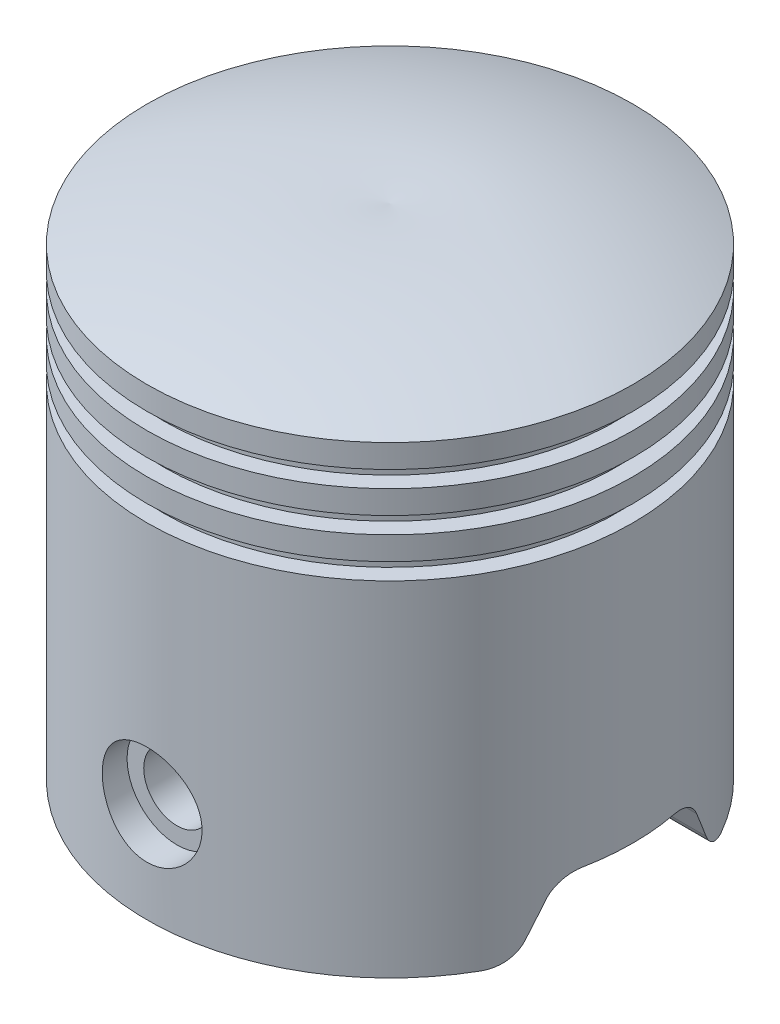
from build123d import *

# Parameters (mm, degrees)
CUT_EXTRUDE1_REACH                   = 93.307
CUT_EXTRUDE1_DIRECTION_2_REACH       = 93.307
FILLET1_R                            = 5
BOSS_EXTRUDE1_REACH                  = 93.307
BOSS_EXTRUDE1_END_RADIUS             = 30.50852022
SKETCH3_R                            = 9
BOSS_EXTRUDE1_DIRECTION_2_REACH      = 93.307
BOSS_EXTRUDE1_DIRECTION_2_END_RADIUS = 30.50852022
CUT_EXTRUDE2_REACH                   = 93.307
CUT_EXTRUDE2_END_RADIUS              = 36.50852022
SKETCH4_R                            = 5
CUT_EXTRUDE2_DIRECTION_2_REACH       = 93.307
CUT_EXTRUDE2_DIRECTION_2_END_RADIUS  = 36.50852022
SKETCH5_R                            = 7.5
CUT_EXTRUDE3_DEPTH                   = 10


with BuildPart() as part:
    # Sketch1 → Revolve1 (revolve)
    with BuildSketch(Plane.XY, mode=Mode.PRIVATE) as revolve1_sk:
        with BuildLine():
            Line((0, 65.6), (0, 70))
            Line((0, 70), (0, 75))
            ThreePointArc((0, 75), (-18.565651024, 74.469071932), (-36.50852022, 69.671288317))
            Line((-36.50852022, 69.671288317), (-36.50852022, 66.171288317))
            Line((-36.50852022, 66.171288317), (-34.00852022, 66.171288317))
            Line((-34.00852022, 66.171288317), (-34.00852022, 63.671288317))
            Line((-34.00852022, 63.671288317), (-36.50852022, 63.671288317))
            Line((-36.50852022, 63.671288317), (-36.50852022, 60.171288317))
            Line((-36.50852022, 60.171288317), (-34.00852022, 60.171288317))
            Line((-34.00852022, 60.171288317), (-34.00852022, 57.671288317))
            Line((-34.00852022, 57.671288317), (-36.50852022, 57.671288317))
            Line((-36.50852022, 57.671288317), (-36.50852022, 54.171288317))
            Line((-36.50852022, 54.171288317), (-34.00852022, 54.171288317))
            Line((-34.00852022, 54.171288317), (-34.00852022, 51.671288317))
            Line((-34.00852022, 51.671288317), (-36.50852022, 51.671288317))
            Line((-36.50852022, 51.671288317), (-36.50852022, 0))
            Line((-36.50852022, 0), (-30.50852022, 0))
            Line((-30.50852022, 0), (-30.50852022, 65.6))
            Line((-30.50852022, 65.6), (0, 65.6))
        make_face()
    revolve(revolve1_sk.sketch.rotate(Axis((0, 70, 0), (0, 1, 0)), 270), axis=Axis((0, 70, 0), (0, 1, 0)))

    # Sketch2 → Cut-Extrude1 (cut, up to next)
    with BuildSketch(Plane(origin=(0, 0, 0), x_dir=(0, 0, -1), z_dir=(1, 0, 0)), mode=Mode.PRIVATE) as cut_extrude1_sk1:
        Polygon((-15, 0), (-10, 10), (10, 10), (15, 0), align=None)
    cut_extrude1_tool1 = extrude(cut_extrude1_sk1.sketch, amount=-CUT_EXTRUDE1_REACH, mode=Mode.PRIVATE) & part.part
    add(cut_extrude1_tool1.solids().sort_by_distance((0, 4.666667, 0))[0], mode=Mode.SUBTRACT)

    # Sketch2 → Cut-Extrude1 direction 2 (cut, up to next)
    with BuildSketch(Plane(origin=(0, 0, 0), x_dir=(0, 0, -1), z_dir=(1, 0, 0)), mode=Mode.PRIVATE) as cut_extrude1_direction_2_sk1:
        Polygon((-15, 0), (-10, 10), (10, 10), (15, 0), align=None)
    cut_extrude1_direction_2_tool1 = extrude(cut_extrude1_direction_2_sk1.sketch, amount=CUT_EXTRUDE1_DIRECTION_2_REACH, mode=Mode.PRIVATE) & part.part
    add(cut_extrude1_direction_2_tool1.solids().sort_by_distance((0, 4.666667, 0))[0], mode=Mode.SUBTRACT)

    # Fillet1
    fillet1_edges = [part.edges().sort_by_distance(p)[0] for p in [
        (31.967677706, 10, -10),
        (-31.967677706, 10, -10),
        (29.92552018, 0, -15),
        (-29.92552018, 0, -15),
        (31.967677706, 10, 10),
        (-31.967677706, 10, 10),
        (-29.92552018, 0, 15),
        (29.92552018, 0, 15),
    ]]
    fillet(fillet1_edges, radius=FILLET1_R)

    # Boss-Extrude1: up to this cylinder (the profile starts inside it)
    boss_extrude1_end = Plane(origin=(0, 15, 0), z_dir=(0, -1, 0)) * Cylinder(BOSS_EXTRUDE1_END_RADIUS, 248.631040439, mode=Mode.PRIVATE)
    # Sketch3 → Boss-Extrude1 (add, up to the surface)
    with BuildSketch(Plane.XY, mode=Mode.PRIVATE) as boss_extrude1_sk1:
        with Locations((0, 15)):
            Circle(SKETCH3_R)
    boss_extrude1_tool1 = extrude(boss_extrude1_sk1.sketch, amount=BOSS_EXTRUDE1_REACH, mode=Mode.PRIVATE) & boss_extrude1_end
    add(boss_extrude1_tool1.solids().sort_by_distance((0, 15, 0))[0])

    # Boss-Extrude1 direction 2: up to this cylinder (the profile starts inside it)
    boss_extrude1_direction_2_end = Plane(origin=(0, 15, 0), z_dir=(0, -1, 0)) * Cylinder(BOSS_EXTRUDE1_DIRECTION_2_END_RADIUS, 248.631040439, mode=Mode.PRIVATE)
    # Sketch3 → Boss-Extrude1 direction 2 (add, up to the surface)
    with BuildSketch(Plane.XY, mode=Mode.PRIVATE) as boss_extrude1_direction_2_sk1:
        with Locations((0, 15)):
            Circle(SKETCH3_R)
    boss_extrude1_direction_2_tool1 = extrude(boss_extrude1_direction_2_sk1.sketch, amount=-BOSS_EXTRUDE1_DIRECTION_2_REACH, mode=Mode.PRIVATE) & boss_extrude1_direction_2_end
    add(boss_extrude1_direction_2_tool1.solids().sort_by_distance((0, 15, 0))[0])

    # Cut-Extrude2: up to this cylinder (the profile starts inside it)
    cut_extrude2_end = Plane(origin=(0, 15, 0), z_dir=(0, -1, 0)) * Cylinder(CUT_EXTRUDE2_END_RADIUS, 260.631040439, mode=Mode.PRIVATE)
    # Sketch4 → Cut-Extrude2 (cut, up to the surface)
    with BuildSketch(Plane.XY, mode=Mode.PRIVATE) as cut_extrude2_sk1:
        with Locations(Location((0, 15, 0), (0, 0, 180))):
            Circle(SKETCH4_R)
    cut_extrude2_tool1 = extrude(cut_extrude2_sk1.sketch, amount=-CUT_EXTRUDE2_REACH, mode=Mode.PRIVATE) & cut_extrude2_end
    add(cut_extrude2_tool1.solids().sort_by_distance((0, 15, 0))[0], mode=Mode.SUBTRACT)

    # Cut-Extrude2 direction 2: up to this cylinder (the profile starts inside it)
    cut_extrude2_direction_2_end = Plane(origin=(0, 15, 0), z_dir=(0, -1, 0)) * Cylinder(CUT_EXTRUDE2_DIRECTION_2_END_RADIUS, 260.631040439, mode=Mode.PRIVATE)
    # Sketch4 → Cut-Extrude2 direction 2 (cut, up to the surface)
    with BuildSketch(Plane.XY, mode=Mode.PRIVATE) as cut_extrude2_direction_2_sk1:
        with Locations(Location((0, 15, 0), (0, 0, 180))):
            Circle(SKETCH4_R)
    cut_extrude2_direction_2_tool1 = extrude(cut_extrude2_direction_2_sk1.sketch, amount=CUT_EXTRUDE2_DIRECTION_2_REACH, mode=Mode.PRIVATE) & cut_extrude2_direction_2_end
    add(cut_extrude2_direction_2_tool1.solids().sort_by_distance((0, 15, 0))[0], mode=Mode.SUBTRACT)

    # Sketch5 → Cut-Extrude3 (cut)
    with BuildSketch(Plane.XY.offset(32)):
        with Locations(Location((0, 15, 0), (0, 0, 180))):
            Circle(SKETCH5_R)
    cut_extrude3 = extrude(amount=CUT_EXTRUDE3_DEPTH, mode=Mode.SUBTRACT)

    # Mirror1: Cut-Extrude3 across plane
    add(cut_extrude3.mirror(Plane.XY), mode=Mode.SUBTRACT)


solid = part.part
